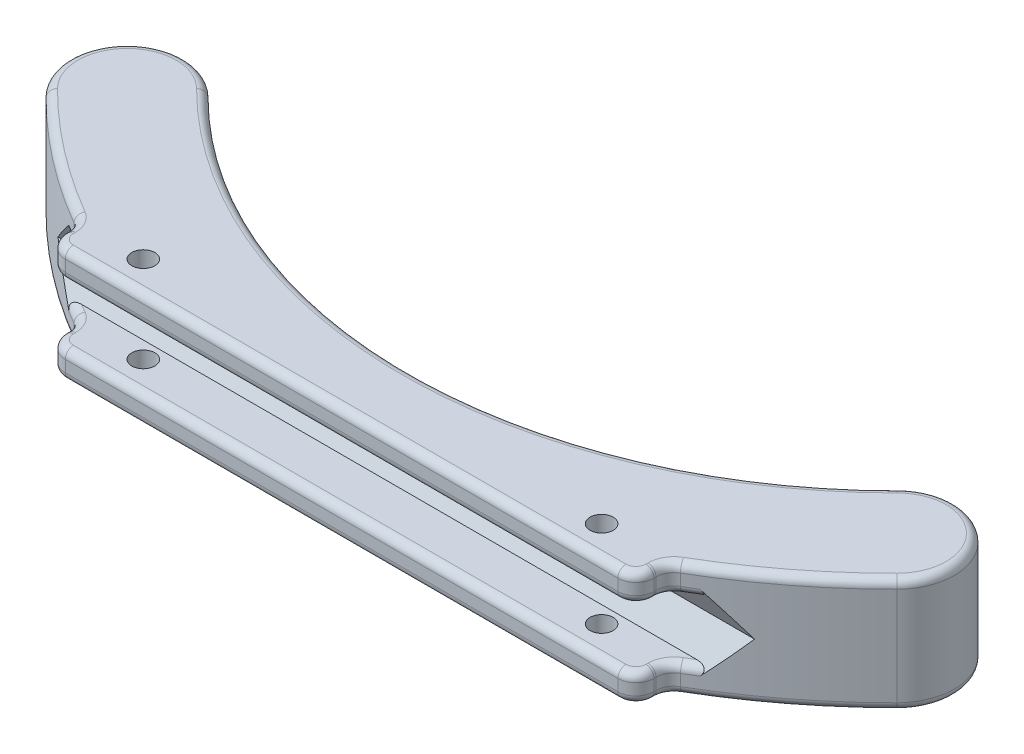
from build123d import *

# Parameters (mm, degrees)
BOSS_EXTRUDE1_DEPTH     = 12.7
CUT_EXTRUDE1_DEPTH      = 109.095060565
CUT_EXTRUDE1_DEPTH_BACK = 109.095060565
F_10_CLEARANCE_HOLE2_D  = 5.1054
SKETCH8_W               = 130.510344418
SKETCH8_H               = 6.15
BOSS_EXTRUDE2_DEPTH     = 3
FILLET1_R               = 4
FILLET2_R               = 1.8


with BuildPart() as part:
    # Sketch1 → Boss-Extrude1 (new, symmetric)
    with BuildSketch(Plane(origin=(0, 0, 0), x_dir=(1, 0, 0), z_dir=(0, 1, 0))):
        with BuildLine():
            Line((-65.255172209, 0), (-65.255172209, -3.78))
            Line((-65.255172209, -3.78), (65.255172209, -3.78))
            Line((65.255172209, -3.78), (65.255172209, 0))
            ThreePointArc((65.255172209, 0), (80.547764726, 10.012717744), (94.32804461, 22.02195539))
            ThreePointArc((94.32804461, 22.02195539), (94.32804461, 39.982467632), (76.367532368, 39.982467632))
            ThreePointArc((76.367532368, 39.982467632), (0, 8.35), (-76.367532368, 39.982467632))
            ThreePointArc((-76.367532368, 39.982467632), (-94.32804461, 39.982467632), (-94.32804461, 22.02195539))
            ThreePointArc((-94.32804461, 22.02195539), (-80.547764726, 10.012717744), (-65.255172209, 0))
        make_face()
    extrude(amount=BOSS_EXTRUDE1_DEPTH, both=True)

    # Sketch3 → Cut-Extrude1 (cut, two sides: drawn at the far end of the back side and taken through both)
    with BuildSketch(Plane(origin=(0, 0, 0), x_dir=(0, 0, -1), z_dir=(1, 0, 0)).offset(-CUT_EXTRUDE1_DEPTH_BACK)):
        Polygon((-7.563288526, 0), (-3.781644263, -6.55), (3.781644263, -6.55), (7.563288526, 0), (3.781644263, 6.55), (-3.781644263, 6.55), align=None)
    extrude(amount=CUT_EXTRUDE1_DEPTH + CUT_EXTRUDE1_DEPTH_BACK, mode=Mode.SUBTRACT)

    # #10 Clearance Hole2 (through all)
    with Locations(Plane(origin=(0, 12.7, 0), x_dir=(1, 0, 0), z_dir=(0, 1, 0))):
        with Locations((-50.8, 0.065822132), (50.8, 0.065822132)):
            Hole(F_10_CLEARANCE_HOLE2_D / 2)

    # Sketch8 → Boss-Extrude2 (add)
    with BuildSketch(Plane.XY.offset(3.78)):
        with Locations((0, -9.625)):
            Rectangle(SKETCH8_W, SKETCH8_H)
        with Locations((0, 9.625)):
            Rectangle(SKETCH8_W, SKETCH8_H)
    extrude(amount=BOSS_EXTRUDE2_DEPTH)

    # Fillet1
    fillet1_edges = [part.edges().sort_by_distance(p)[0] for p in [
        (65.255172209, 9.625, 0),
        (-65.255172209, 9.625, 0),
        (65.255172209, -9.625, 0),
        (-65.255172209, -9.625, 0),
        (65.255172209, -9.625, 6.78),
        (-65.255172209, -9.625, 6.78),
        (-65.255172209, 9.625, 6.78),
        (65.255172209, 9.625, 6.78),
    ]]
    fillet(fillet1_edges, radius=FILLET1_R)

    # Fillet2
    fillet2_edges = [part.edges().sort_by_distance(p)[0] for p in [
        (81.455776786, -12.7, -10.706654596),
        (65.255172209, -12.7, 2.54981508),
        (-65.255172209, -12.7, 2.54981508),
        (64.083599334, -12.7, 5.608427125),
        (-64.083599334, -12.7, 5.608427125),
        (-65.255172209, -6.55, 2.54981508),
        (65.255172209, -6.55, 2.54981508),
        (-69.422917101, -6.55, -2.437671514),
        (64.083599334, -6.55, 5.608427125),
        (-64.083599334, -6.55, 5.608427125),
        (0, 12.7, 6.78),
        (0, 6.55, 6.78),
        (69.422917101, 6.55, -2.437671514),
        (65.255172209, 6.55, 2.54981508),
        (-65.255172209, 6.55, 2.54981508),
        (64.083599334, 6.55, 5.608427125),
        (-64.083599334, 6.55, 5.608427125),
        (-65.255172209, 12.7, 2.54981508),
        (-81.455776786, -12.7, -10.706654596),
        (65.255172209, 12.7, 2.54981508),
        (81.455776786, 12.7, -10.706654596),
        (64.083599334, 12.7, 5.608427125),
        (-64.083599334, 12.7, 5.608427125),
        (65.786408101, -12.7, 0.327727662),
        (65.786408101, -6.55, 0.327727662),
        (65.786408101, 6.55, 0.327727662),
        (65.786408101, 12.7, 0.327727662),
        (-65.786408101, -12.7, 0.327727662),
        (-65.786408101, -6.55, 0.327727662),
        (-65.786408101, 6.55, 0.327727662),
        (-65.786408101, 12.7, 0.327727662),
        (69.422917101, -6.55, -2.437671514),
        (94.32804461, 12.7, -39.982467632),
        (0, 12.7, -8.35),
        (-69.422917101, 6.55, -2.437671514),
        (-94.32804461, 12.7, -39.982467632),
        (-81.455776786, 12.7, -10.706654596),
        (-94.32804461, -12.7, -39.982467632),
        (0, -12.7, -8.35),
        (94.32804461, -12.7, -39.982467632),
        (0, -12.7, 6.78),
        (0, -6.55, 6.78),
    ]]
    fillet(fillet2_edges, radius=FILLET2_R)


solid = part.part
